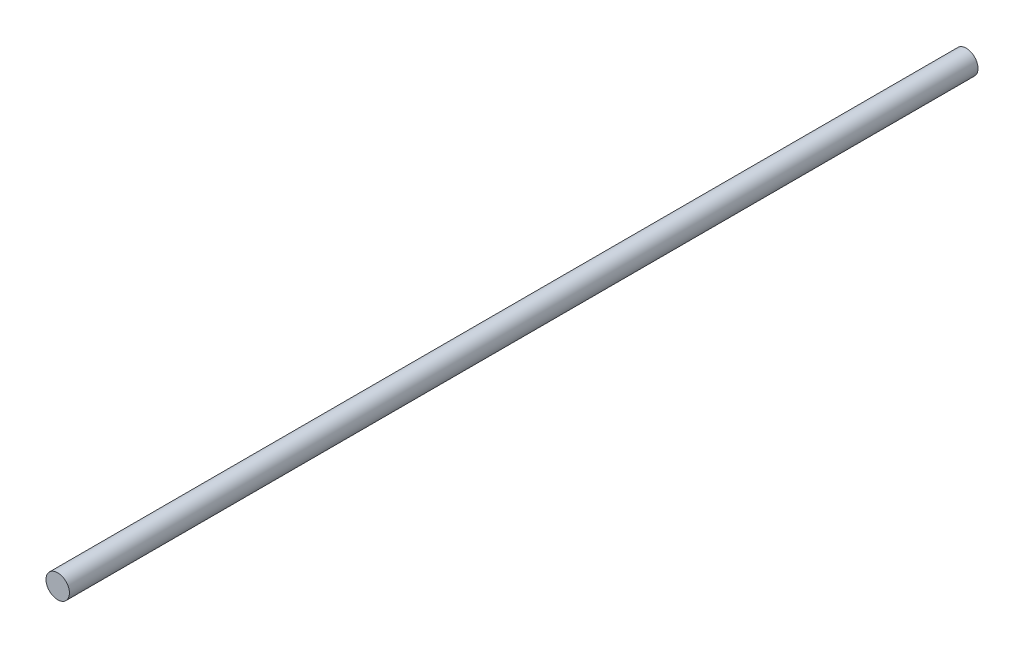
from build123d import *

# Parameters (mm, degrees)
CROQUIS1_R              = 4
SALIENTE_EXTRUIR1_DEPTH = 310


with BuildPart() as part:
    # Croquis1 → Saliente-Extruir1 (new body)
    with BuildSketch(Plane.XY):
        Circle(CROQUIS1_R)
    extrude(amount=SALIENTE_EXTRUIR1_DEPTH)


solid = part.part
